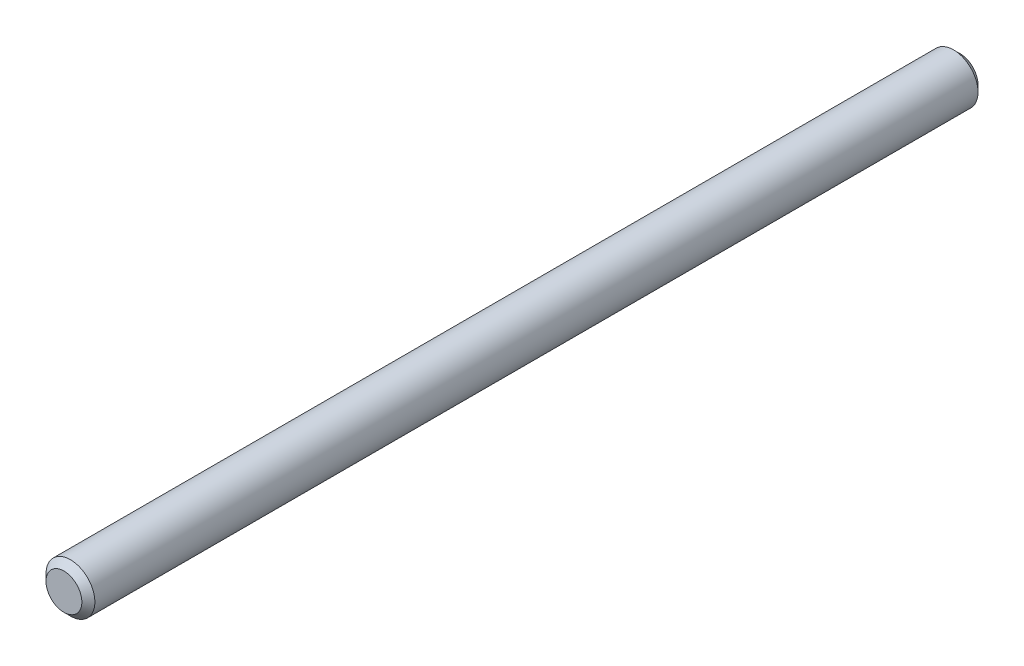
from build123d import *

# Parameters (mm, degrees)
SKETCH2_R           = 7.5
BOSS_EXTRUDE1_DEPTH = 137.5
CHAMFER1_SIZE       = 2


with BuildPart() as part:
    # Sketch2 → Boss-Extrude1 (new, symmetric)
    with BuildSketch(Plane.XY):
        Circle(SKETCH2_R)
    extrude(amount=BOSS_EXTRUDE1_DEPTH, both=True)

    # Chamfer1
    chamfer1_edges = [part.edges().sort_by_distance(p)[0] for p in [
        (-7.5, 0, -137.5),
        (-7.5, 0, 137.5),
    ]]
    chamfer(chamfer1_edges, length=CHAMFER1_SIZE)


solid = part.part
